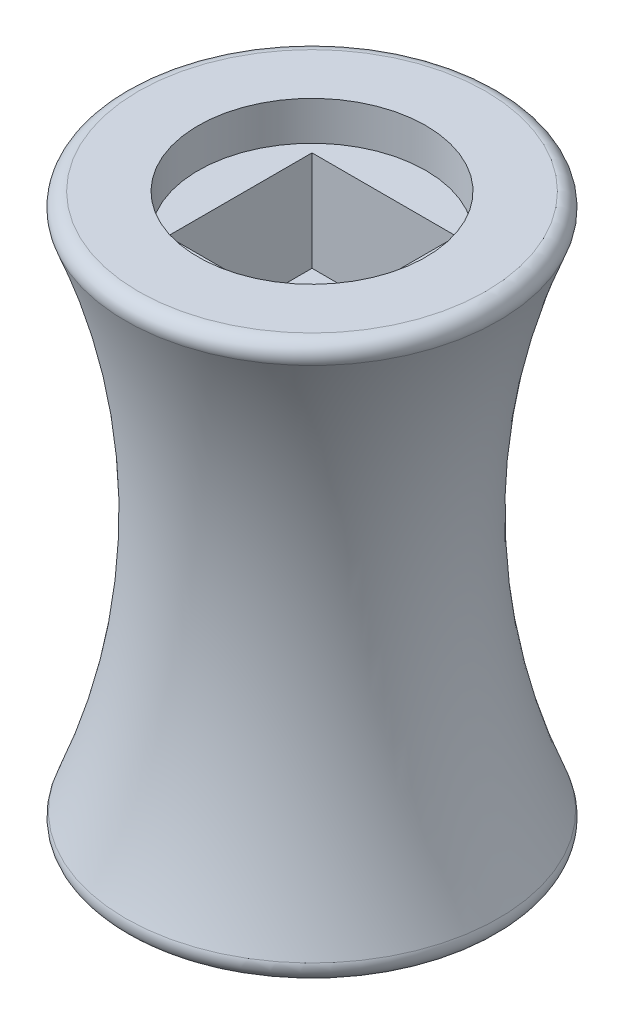
from build123d import *

# Parameters (mm, degrees)
SKETCH2_W           = 6.604
SKETCH2_H           = 6.604
CUT_EXTRUDE1_DEPTH  = 29.341210278
SKETCH3_R           = 5.207
CUT_EXTRUDE2_DEPTH  = 1.778
FILLET1_R           = 0.635
SKETCH4_W           = 6.604
SKETCH4_H           = 6.604
SKETCH4_R           = 2.54
BOSS_EXTRUDE1_DEPTH = 6.35


with BuildPart() as part:
    # Sketch1 → Revolve1 (revolve)
    with BuildSketch(Plane(origin=(0, 0, 0), x_dir=(0, 0, -1), z_dir=(1, 0, 0))):
        with BuildLine():
            Line((2.54, 0), (2.54, 25.4))
            Line((2.54, 25.4), (8.89, 25.4))
            ThreePointArc((8.89, 25.4), (6.239355663, 12.7), (8.89, 0))
            Line((8.89, 0), (2.54, 0))
        make_face()
    revolve(axis=Axis((0, 0, 0), (0, 1, 0)))

    # Sketch2 → Cut-Extrude1 (cut, through all)
    with BuildSketch(Plane.XZ):
        Rectangle(SKETCH2_W, SKETCH2_H)
    extrude(amount=-CUT_EXTRUDE1_DEPTH, mode=Mode.SUBTRACT)

    # Sketch3 → Cut-Extrude2 (cut)
    with BuildSketch(Plane.XZ):
        with Locations(Location((0, 0, 0), (0, 0, 270))):
            Circle(SKETCH3_R)
    cut_extrude2 = extrude(amount=-CUT_EXTRUDE2_DEPTH, mode=Mode.SUBTRACT)

    # Fillet1
    fillet1_edges = [part.edges().sort_by_distance(p)[0] for p in [
        (0, 25.4, 8.89),
        (0, 0, 8.89),
    ]]
    fillet(fillet1_edges, radius=FILLET1_R)

    # Mirror1: Cut-Extrude2 across plane
    add(cut_extrude2.mirror(Plane(origin=(0, 12.7, 0), x_dir=(0, 0, 1), z_dir=(0, -1, 0))), mode=Mode.SUBTRACT)

    # Sketch4 → Boss-Extrude1 (add, symmetric)
    with BuildSketch(Plane(origin=(0, 12.7, 0), x_dir=(-1, 0, 0), z_dir=(0, -1, 0))):
        Rectangle(SKETCH4_W, SKETCH4_H)
        with Locations(Location((0, 0, 0), (0, 0, 90))):
            Circle(SKETCH4_R, mode=Mode.SUBTRACT)
    extrude(amount=BOSS_EXTRUDE1_DEPTH, both=True)


solid = part.part
